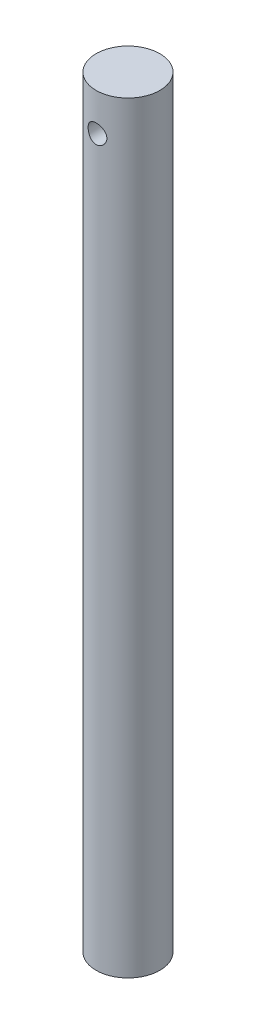
from build123d import *

# Parameters (mm, degrees)
SKETCH1_R               = 8.5
BOSS_EXTRUDE1_DEPTH     = 203.2
CUT_EXTRUDE1_DEPTH      = 205.086966757
CUT_EXTRUDE1_DEPTH_BACK = 205.086966757
SKETCH4_R               = 2.5


with BuildPart() as part:
    # Sketch1 → Boss-Extrude1 (new body)
    with BuildSketch(Plane(origin=(0, 0, 0), x_dir=(1, 0, 0), z_dir=(0, 1, 0))):
        with Locations(Location((0, 0, 0), (0, 0, 270))):
            Circle(SKETCH1_R)
    extrude(amount=BOSS_EXTRUDE1_DEPTH)

    # Sketch4 → Cut-Extrude1 (cut, two sides: drawn at the far end of the back side and taken through both)
    with BuildSketch(Plane.XY.offset(8.5).offset(-CUT_EXTRUDE1_DEPTH_BACK)):
        with Locations(Location((0, 193.2, 0), (0, 0, 89.999999976))):
            Circle(SKETCH4_R)
    extrude(amount=CUT_EXTRUDE1_DEPTH + CUT_EXTRUDE1_DEPTH_BACK, mode=Mode.SUBTRACT)


solid = part.part
